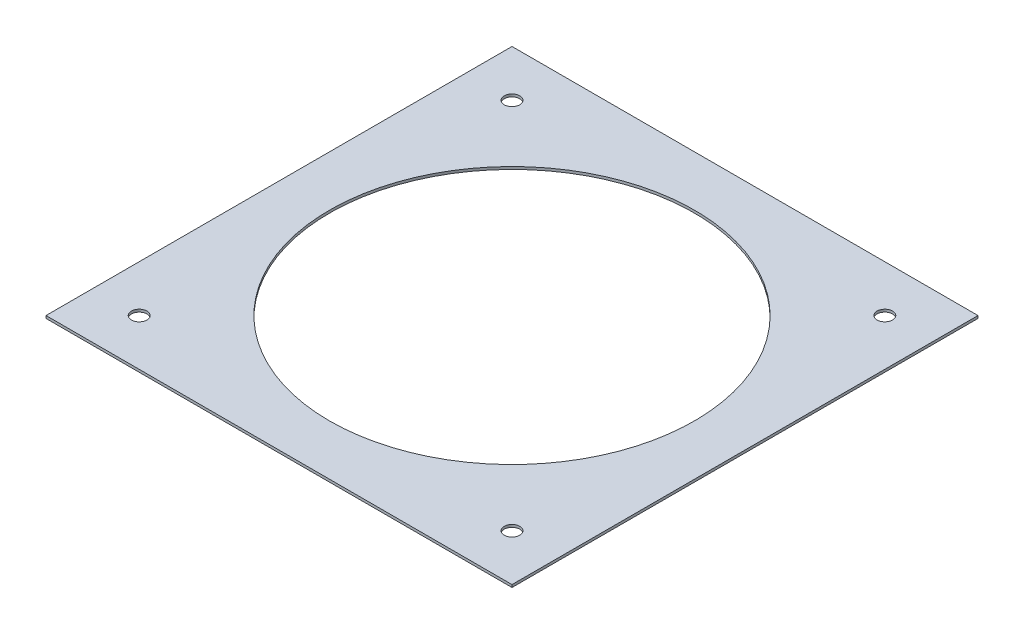
from build123d import *

# Parameters (mm, degrees)
SKETCH1_W           = 152.4
SKETCH1_H           = 152.4
SKETCH1_R           = 59.69
BOSS_EXTRUDE1_DEPTH = 0.4191
SKETCH2_R           = 2.54
CUT_EXTRUDE1_DEPTH  = 108.766333236
CIRPATTERN1_COUNT   = 4


with BuildPart() as part:
    # Sketch1 → Boss-Extrude1 (new, symmetric)
    with BuildSketch(Plane(origin=(0, 0, 0), x_dir=(1, 0, 0), z_dir=(0, 1, 0))):
        Rectangle(SKETCH1_W, SKETCH1_H)
        with Locations(Location((0, 0, 0), (0, 0, 270))):
            Circle(SKETCH1_R, mode=Mode.SUBTRACT)
    extrude(amount=BOSS_EXTRUDE1_DEPTH, both=True)

    # Sketch2 → Cut-Extrude1 (cut, through all)
    with BuildSketch(Plane(origin=(0, 0.4191, 0), x_dir=(1, 0, 0), z_dir=(0, 1, 0))):
        with Locations(Location((-60.96, 60.96, 0), (0, 0, 270))):
            Circle(SKETCH2_R)
    cut_extrude1 = extrude(amount=-CUT_EXTRUDE1_DEPTH, mode=Mode.SUBTRACT)

    # CirPattern1: Cut-Extrude1 ×4 about axis
    cirpattern1_axis = Axis((0, 0, 0), (0, 1, 0))
    for i in range(1, CIRPATTERN1_COUNT):
        add(cut_extrude1.rotate(cirpattern1_axis, i * 360 / CIRPATTERN1_COUNT), mode=Mode.SUBTRACT)


solid = part.part
